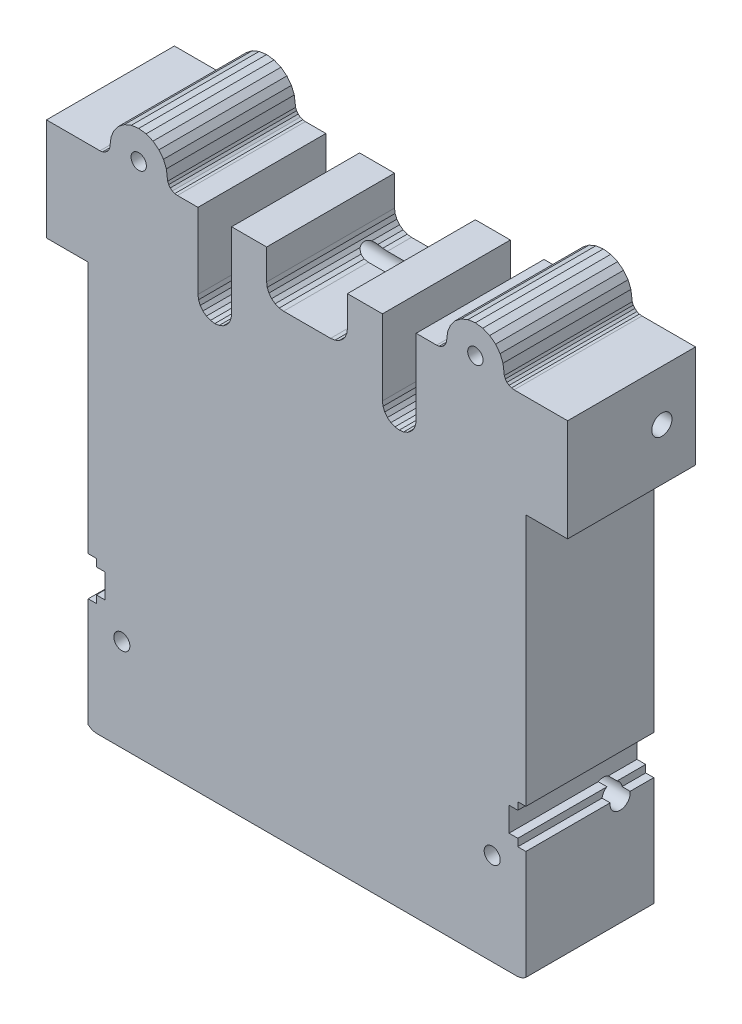
from build123d import *

# Parameters (mm, degrees)
CROQUIS3_R              = 11.401652729
CROQUIS3_R_2            = 11.401667337
CROQUIS3_R_3            = 11.897340247
CROQUIS3_R_4            = 11.897352739
SALIENTE_EXTRUIR3_DEPTH = 190
ESCALA1_SCALE           = 0.1
CORTAR_EXTRUIR1_REACH   = 445.395
CROQUIS4_R              = 1.5


with BuildPart() as part:
    # Croquis3 → Saliente-Extruir3 (new body)
    with BuildSketch(Plane.XY):
        Polygon((62.000007629, 600), (62.000007629, 225.000019073), (74.00001049, 225.000019073), (74.00001049, 214.000015259), (87.000007629, 214.000015259), (87.000007629, 178.000011444), (74.00001049, 178.000011444), (74.00001049, 167.000007629), (62.000007629, 167.000007629), (62.000007629, 5.000014305), (65.960402489, 2.275037766), (70.457281385, 0.575536435), (75.230016146, 1.277e-05), (698.796314631, 1.277e-05), (703.5598034, 0.579722678), (708.047413263, 2.279101392), (712.000045776, 5.000014305), (712.000045776, 167.000007629), (700, 167.000007629), (700, 178.000011444), (687.000045776, 178.000011444), (687.000045776, 214.000015259), (700, 214.000015259), (700, 225.000019073), (712.000045776, 225.000019073), (712.000045776, 600), (774.000005259, 600), (774.000005259, 752.00002538), (694.509434327, 752.00002538), (690.625557849, 752.509989697), (687.005212426, 754.008120277), (683.896969683, 756.390727503), (681.511844529, 759.497038521), (680.011611015, 763.116513016), (679.499106553, 767.000055121), (678.047678684, 777.998361779), (673.800452258, 788.246775122), (667.046530749, 797.047511795), (658.245794076, 803.801433304), (647.997385964, 808.04865973), (636.999123424, 809.500087598), (626.000816766, 808.04865973), (615.752403424, 803.801433304), (606.95162999, 797.047511795), (600.197708482, 788.246775122), (595.950463171, 777.998361779), (594.499035302, 767.000055121), (593.986767843, 763.118308924), (592.487747317, 759.501223225), (590.103931003, 756.3950759), (586.997742405, 754.011313366), (583.380656707, 752.512292839), (579.49891051, 752.00002538), (548.999055228, 752.00002538), (548.999055228, 639.999074709), (548.147197279, 633.528619953), (545.649669298, 627.49905312), (541.676700243, 622.321402668), (536.499049791, 618.348433613), (530.469542427, 615.850917196), (523.99905113, 614.999054437), (517.528559834, 615.850917196), (511.499052469, 618.348433613), (506.321327187, 622.321402668), (502.348358132, 627.49905312), (499.850909117, 633.528619953), (498.999051168, 639.999074709), (498.999051168, 752.00002538), (446.998930409, 752.00002538), (446.998930409, 707.189762429), (446.168386872, 700.691496039), (443.684287831, 694.629639501), (439.715890971, 689.4172413), (434.533657196, 685.409524601), (428.490716264, 682.879616244), (421.998901713, 682.000023228), (352.188721049, 682.000023228), (345.690420663, 682.830483045), (339.628518676, 685.314615834), (334.416116333, 689.283045399), (330.408433532, 694.465235341), (327.878564453, 700.508173573), (326.998895263, 707.00002538), (326.998895263, 752.00002538), (274.999042406, 752.00002538), (274.999042406, 639.999074709), (274.147184457, 633.528619953), (271.649656477, 627.49905312), (267.676700082, 622.321402668), (262.499033131, 618.348433613), (256.469494216, 615.850917196), (249.999032319, 614.999054437), (243.528541023, 615.850917196), (237.499033658, 618.348433613), (232.321366707, 622.321402668), (228.348397652, 627.49905312), (225.850869671, 633.528619953), (224.999011722, 639.999074709), (224.999011722, 752.00002538), (194.509863476, 752.00002538), (190.625986998, 752.509989697), (187.007479722, 754.008120277), (183.899236979, 756.390727503), (181.514111826, 759.497038521), (180.012558361, 763.116513016), (179.500053899, 767.000055121), (178.04862603, 777.998361779), (173.801399604, 788.246775122), (167.047478096, 797.047511795), (158.246713776, 803.801433304), (147.998300434, 808.04865973), (136.999993776, 809.500087598), (126.001687117, 808.04865973), (115.753273775, 803.801433304), (106.952500342, 797.047511795), (100.198578833, 788.246775122), (95.951352407, 777.998361779), (94.499924539, 767.000055121), (93.987657079, 763.118308924), (92.488636553, 759.501223225), (90.104895736, 756.3950759), (86.998707138, 754.011313366), (83.381621439, 752.512292839), (79.499875242, 752.00002538), (0, 752.00002538), (0, 600), align=None)
        with Locations((136.999993776, 767.000055121)):
            Circle(CROQUIS3_R, mode=Mode.SUBTRACT)
        with Locations((636.999123424, 767.000055121)):
            Circle(CROQUIS3_R_2, mode=Mode.SUBTRACT)
        with Locations((112.000007629, 137.000017166)):
            Circle(CROQUIS3_R_3, mode=Mode.SUBTRACT)
        with Locations((662.000007629, 137.000017166)):
            Circle(CROQUIS3_R_4, mode=Mode.SUBTRACT)
    extrude(amount=SALIENTE_EXTRUIR3_DEPTH)


with BuildPart() as part_1:
    # Escala1: scaled about (387.000056508, 381.051372624, 95)
    add(part.part.scale(ESCALA1_SCALE).moved(Location((348.300050857, 342.946235362, 85.5))))

    # Cortar-Extruir1: up to this face of the body (flat: up to its plane)
    cortar_extruir1_end = Plane(part_1.part.faces().sort_by_distance((425.700051383, 410.546236631, 95))[0])
    # Croquis4 → Cortar-Extruir1 (cut, up to the picked face)
    with BuildSketch(Plane.ZY.offset(-348.300050857), mode=Mode.PRIVATE) as cortar_extruir1_sk1:
        with Locations((90.5, 410.646237899)):
            Circle(CROQUIS4_R)
    cortar_extruir1_tool1 = split(extrude(cortar_extruir1_sk1.sketch, amount=-CORTAR_EXTRUIR1_REACH, mode=Mode.PRIVATE), bisect_by=cortar_extruir1_end, keep=Keep.BOTH, mode=Mode.PRIVATE)
    # Croquis4 → Cortar-Extruir1 (cut, up to the picked face)
    with BuildSketch(Plane.ZY.offset(-348.300050857), mode=Mode.PRIVATE) as cortar_extruir1_sk2:
        with Locations(Location((90.5, 359.446236792, 0), (0, 0, 7.662229932))):
            Circle(CROQUIS4_R)
    cortar_extruir1_tool2 = split(extrude(cortar_extruir1_sk2.sketch, amount=-CORTAR_EXTRUIR1_REACH, mode=Mode.PRIVATE), bisect_by=cortar_extruir1_end, keep=Keep.BOTH, mode=Mode.PRIVATE)
    add(cortar_extruir1_tool1.solids().sort_by(Axis((348.300051, 410.646238, 90.5), (1, 0, 0)))[0], mode=Mode.SUBTRACT)
    add(cortar_extruir1_tool2.solids().sort_by(Axis((348.300051, 359.446237, 90.5), (1, 0, 0)))[0], mode=Mode.SUBTRACT)


solid = part_1.part
